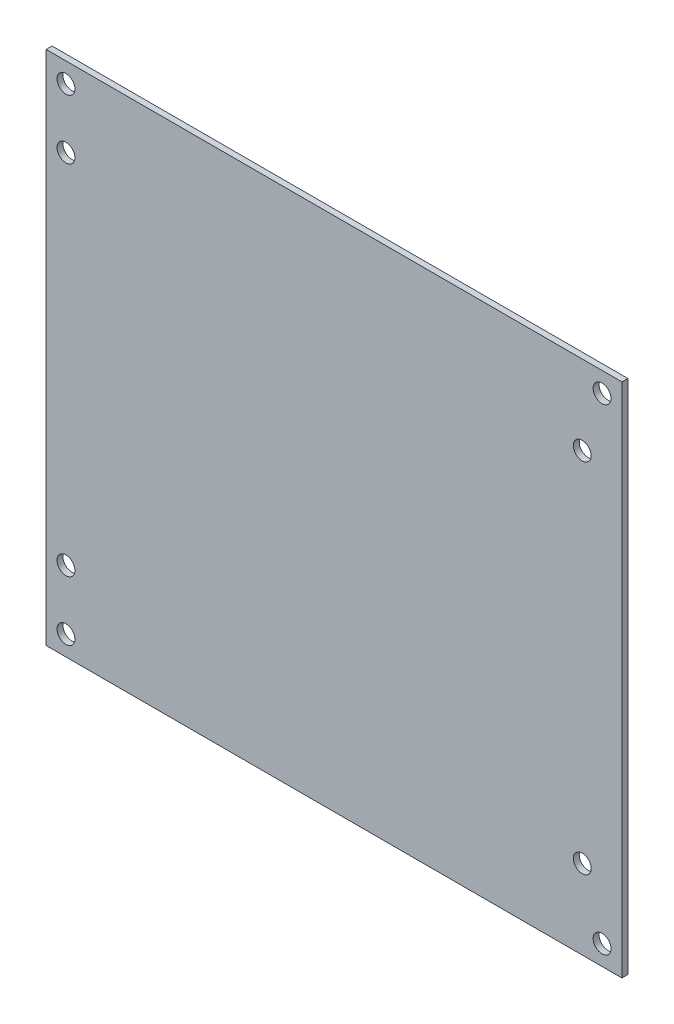
from build123d import *

# Parameters (mm, degrees)
SKETCH_1_W      = 145
SKETCH_1_H      = 130
SKETCH_1_R      = 2.25
EXTRUDE_1_DEPTH = 1.5


with BuildPart() as part:
    # Эскиз1 → Вытянуть1 (new body)
    with BuildSketch(Plane.XY):
        Rectangle(SKETCH_1_W, SKETCH_1_H)
        with Locations((-67.5, 60)):
            Circle(SKETCH_1_R, mode=Mode.SUBTRACT)
        with Locations(Location((-67.5, -60, 0), (0, 0, 180))):
            Circle(SKETCH_1_R, mode=Mode.SUBTRACT)
        with Locations((67.5, -60)):
            Circle(SKETCH_1_R, mode=Mode.SUBTRACT)
        with Locations(Location((67.5, 60, 0), (0, 0, 180))):
            Circle(SKETCH_1_R, mode=Mode.SUBTRACT)
        with Locations((-67.5, 45)):
            Circle(SKETCH_1_R, mode=Mode.SUBTRACT)
        with Locations(Location((-67.5, -45, 0), (0, 0, 180))):
            Circle(SKETCH_1_R, mode=Mode.SUBTRACT)
        with Locations((62.5, 45)):
            Circle(SKETCH_1_R, mode=Mode.SUBTRACT)
        with Locations(Location((62.5, -45, 0), (0, 0, 180))):
            Circle(SKETCH_1_R, mode=Mode.SUBTRACT)
    extrude(amount=EXTRUDE_1_DEPTH)


solid = part.part
